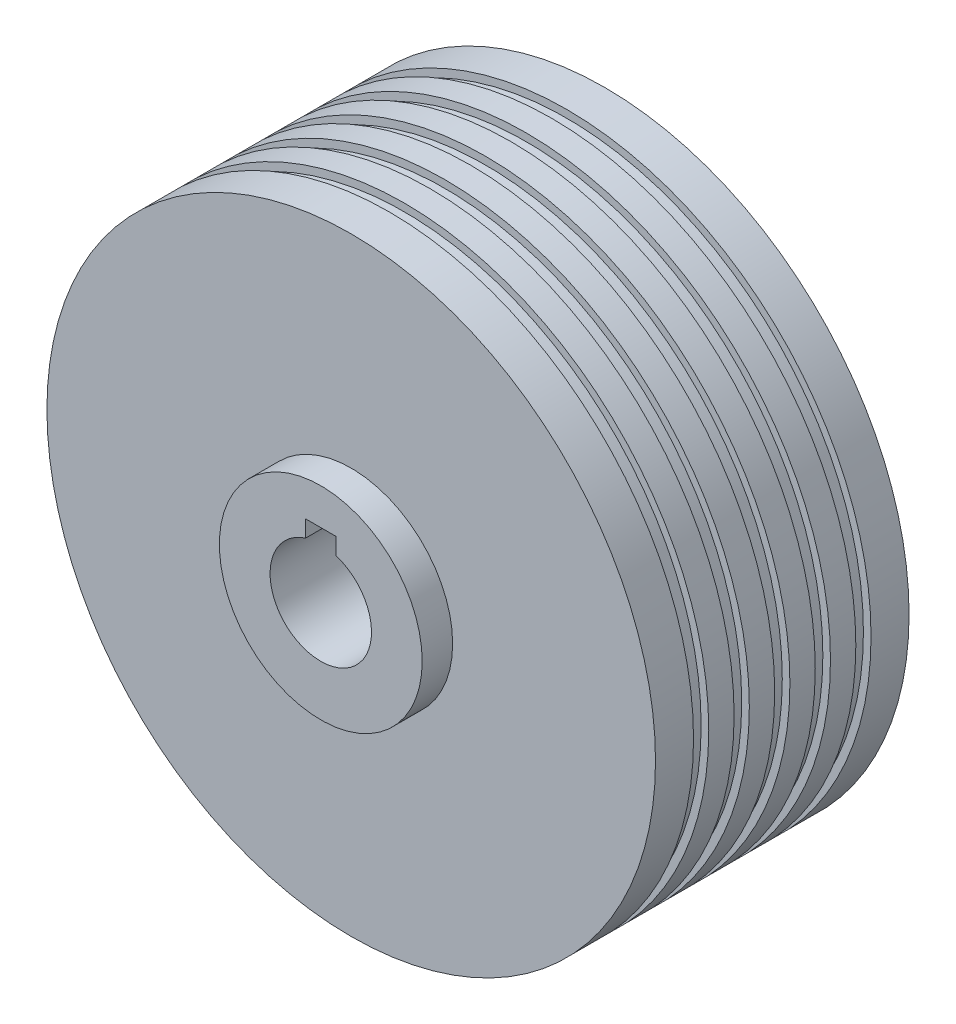
from build123d import *

# Parameters (mm, degrees)
SKETCH1_R               = 30
BOSS_EXTRUDE1_DEPTH     = 25
CUT_EXTRUDE1_DEPTH      = 1
CUT_EXTRUDE1_DEPTH_BACK = 43
SKETCH2_R               = 5
SKETCH3_W               = 1.5
SKETCH3_H               = 1.5
SKETCH5_R               = 10
BOSS_EXTRUDE2_DEPTH     = 3
SKETCH6_R               = 5
CUT_EXTRUDE3_DEPTH      = 3
CUT_EXTRUDE4_START      = -38
CUT_EXTRUDE4_DEPTH      = 38


with BuildPart() as part:
    # Sketch1 → Boss-Extrude1 (new body)
    with BuildSketch(Plane.XY):
        Circle(SKETCH1_R)
    extrude(amount=BOSS_EXTRUDE1_DEPTH)

    # Sketch2 → Cut-Extrude1 (cut, two sides: drawn at the far end of the back side and taken through both)
    with BuildSketch(Plane.XY.offset(25).offset(-CUT_EXTRUDE1_DEPTH_BACK)):
        Circle(SKETCH2_R)
    extrude(amount=CUT_EXTRUDE1_DEPTH + CUT_EXTRUDE1_DEPTH_BACK, mode=Mode.SUBTRACT)

    # Sketch3 → Cut-Revolve2 (revolve, cut)
    with BuildSketch(Plane(origin=(0, 0, 0), x_dir=(0, 0, -1), z_dir=(1, 0, 0)), mode=Mode.PRIVATE) as cut_revolve2_sk:
        with Locations((-12.5, 30)):
            Rectangle(SKETCH3_W, SKETCH3_H)
        with Locations((-8.5, 30)):
            Rectangle(SKETCH3_W, SKETCH3_H)
        with Locations((-4.5, 30)):
            Rectangle(SKETCH3_W, SKETCH3_H)
        with Locations((-16.5, 30)):
            Rectangle(SKETCH3_W, SKETCH3_H)
        with Locations((-20.5, 30)):
            Rectangle(SKETCH3_W, SKETCH3_H)
    revolve(cut_revolve2_sk.sketch.rotate(Axis((0, 0, 25), (0, 0, -1)), 90), axis=Axis((0, 0, 25), (0, 0, -1)), mode=Mode.SUBTRACT)

    # Sketch5 → Boss-Extrude2 (add)
    with BuildSketch(Plane.XY.offset(25)):
        Circle(SKETCH5_R)
    extrude(amount=BOSS_EXTRUDE2_DEPTH)

    # Sketch6 → Cut-Extrude3 (cut)
    with BuildSketch(Plane.XY.offset(28)):
        Circle(SKETCH6_R)
    extrude(amount=-CUT_EXTRUDE3_DEPTH, mode=Mode.SUBTRACT)

    # Sketch7 → Cut-Extrude4 (cut)
    with BuildSketch(Plane(origin=(0, 0, 0), x_dir=(-1, 0, 0), z_dir=(0, 0, -1)).offset(CUT_EXTRUDE4_START)):
        with BuildLine():
            Line((-1.5, 6.419696007), (1.5, 6.419696007))
            Line((1.5, 6.419696007), (1.5, 4.769696007))
            ThreePointArc((1.5, 4.769696007), (0, 5), (-1.5, 4.769696007))
            Line((-1.5, 4.769696007), (-1.5, 6.419696007))
        make_face()
    extrude(amount=CUT_EXTRUDE4_DEPTH, mode=Mode.SUBTRACT)


solid = part.part
